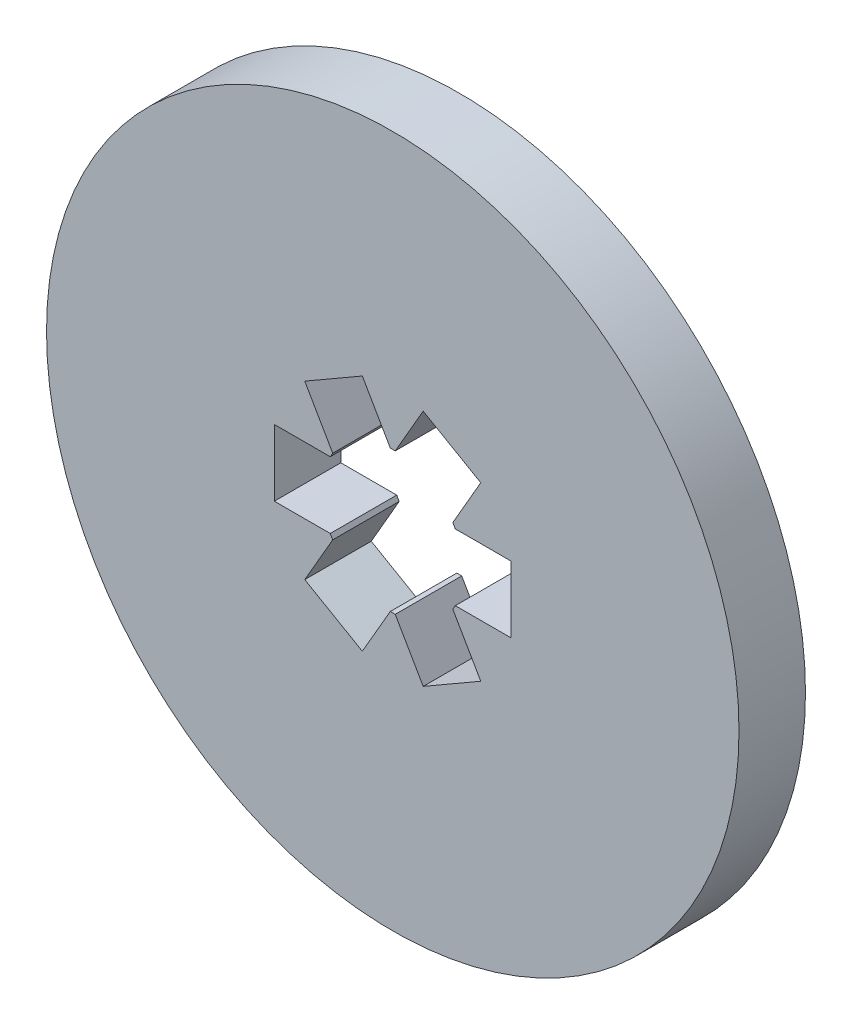
from build123d import *

# Parameters (mm, degrees)
SKETCH1_R           = 7.9375
BOSS_EXTRUDE1_DEPTH = 1.524


with BuildPart() as part:
    # Sketch1 → Boss-Extrude1 (new body)
    with BuildSketch(Plane.XY):
        with Locations(Location((107.492585866, -0.762, 0), (0, 0, 180))):
            Circle(SKETCH1_R)
        Polygon((110.207675722, 0), (110.207675722, -1.524), (108.925853356, -1.524), (108.869130969, -1.622246056), (109.510042152, -2.732336789), (108.190219437, -3.494336789), (107.549308253, -2.384246056), (107.435863479, -2.384246056), (106.794952296, -3.494336789), (105.47512958, -2.732336789), (106.116040764, -1.622246056), (106.059318377, -1.524), (104.77749601, -1.524), (104.77749601, 0), (106.059318377, 0), (106.116040764, 0.098246056), (105.47512958, 1.208336789), (106.794952296, 1.970336789), (107.435863479, 0.860246056), (107.549308253, 0.860246056), (108.190219437, 1.970336789), (109.510042152, 1.208336789), (108.869130969, 0.098246056), (108.925853356, 0), align=None, mode=Mode.SUBTRACT)
    extrude(amount=BOSS_EXTRUDE1_DEPTH)


solid = part.part
